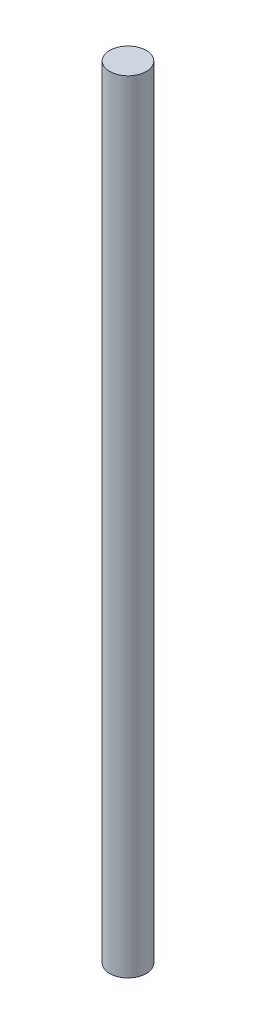
from build123d import *

# Parameters (mm, degrees)
SKETCH1_R           = 6.35
BOSS_EXTRUDE1_DEPTH = 271.71015


with BuildPart() as part:
    # Sketch1 → Boss-Extrude1 (new body)
    with BuildSketch(Plane(origin=(0, 0, 0), x_dir=(1, 0, 0), z_dir=(0, 1, 0))):
        with Locations(Location((0, 0, 0), (0, 0, 270))):
            Circle(SKETCH1_R)
    extrude(amount=BOSS_EXTRUDE1_DEPTH)


solid = part.part
